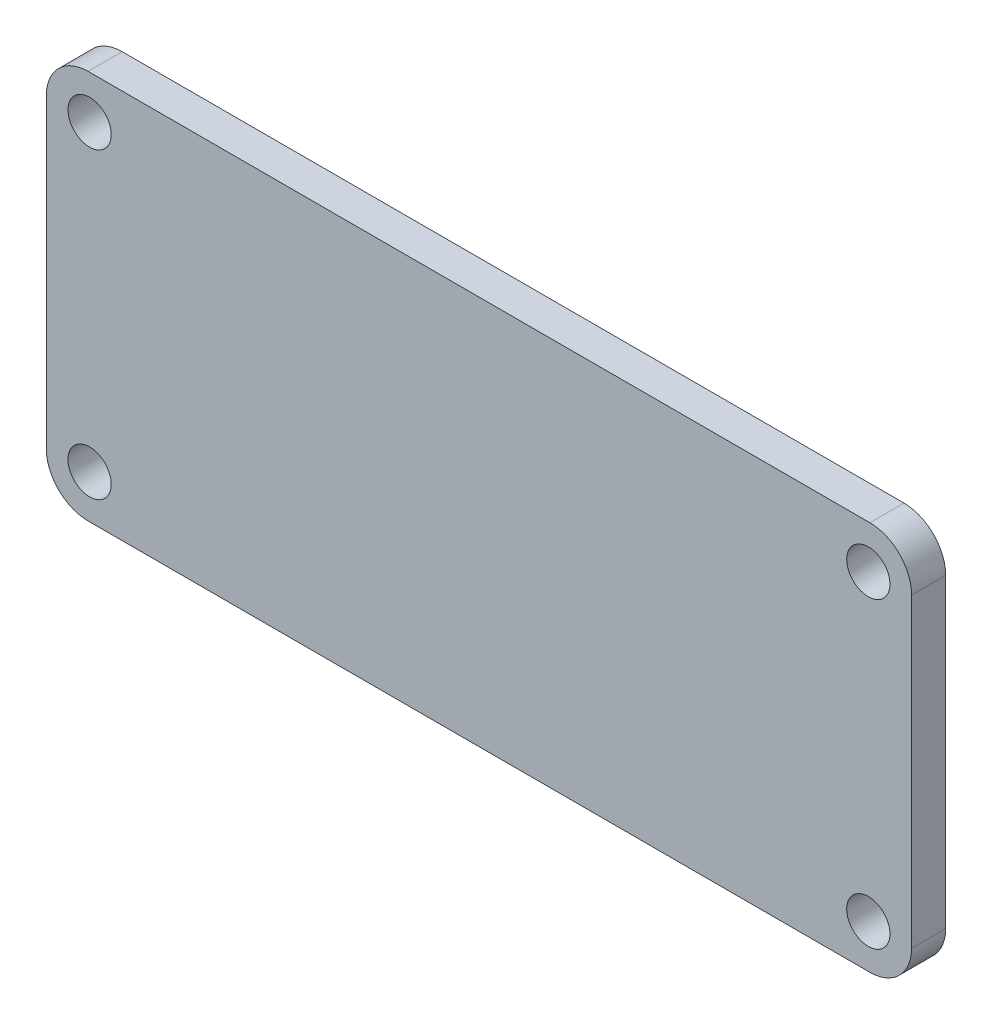
from build123d import *

# Parameters (mm, degrees)
CROQUIS1_R              = 1.27
SALIENTE_EXTRUIR1_DEPTH = 2


with BuildPart() as part:
    # Croquis1 → Saliente-Extruir1 (new body)
    with BuildSketch(Plane.XY):
        with BuildLine():
            Line((22.95, -11.43), (-22.95, -11.43))
            ThreePointArc((-22.95, -11.43), (-24.682411614, -10.712411614), (-25.4, -8.98))
            Line((-25.4, -8.98), (-25.4, 8.98))
            ThreePointArc((-25.4, 8.98), (-24.682411614, 10.712411614), (-22.95, 11.43))
            Line((-22.95, 11.43), (22.95, 11.43))
            ThreePointArc((22.95, 11.43), (24.682411614, 10.712411614), (25.4, 8.98))
            Line((25.4, 8.98), (25.4, -8.98))
            ThreePointArc((25.4, -8.98), (24.682411614, -10.712411614), (22.95, -11.43))
        make_face()
        with Locations((-22.86, 8.89)):
            Circle(CROQUIS1_R, mode=Mode.SUBTRACT)
        with Locations(Location((-22.86, -8.89, 0), (0, 0, 180))):
            Circle(CROQUIS1_R, mode=Mode.SUBTRACT)
        with Locations((22.86, -8.89)):
            Circle(CROQUIS1_R, mode=Mode.SUBTRACT)
        with Locations(Location((22.86, 8.89, 0), (0, 0, 180))):
            Circle(CROQUIS1_R, mode=Mode.SUBTRACT)
    extrude(amount=SALIENTE_EXTRUIR1_DEPTH)


solid = part.part
